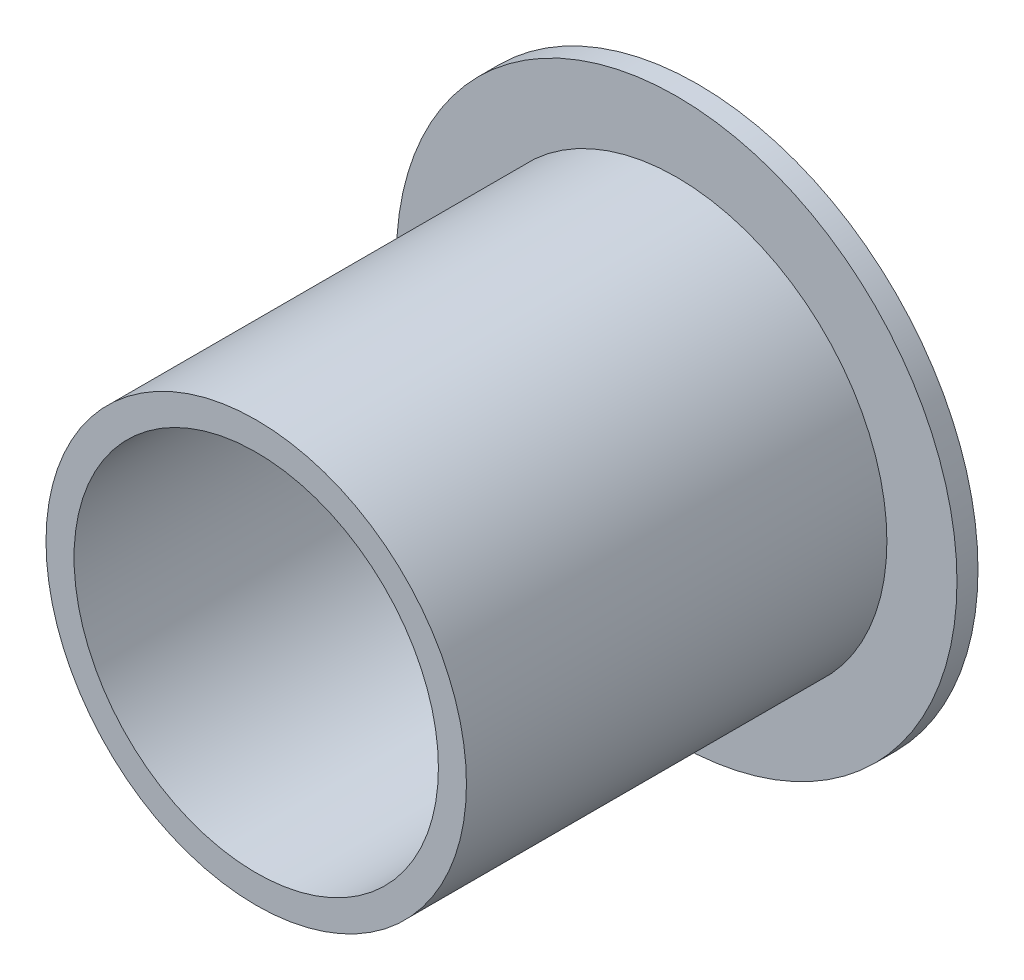
from build123d import *

# Parameters (mm, degrees)
SKETCH1_R           = 20
BOSS_EXTRUDE1_DEPTH = 1.5
SKETCH2_R           = 15
SKETCH2_R_2         = 13
BOSS_EXTRUDE2_DEPTH = 30
SKETCH3_R           = 10
CUT_EXTRUDE1_DEPTH  = 30


with BuildPart() as part:
    # Sketch1 → Boss-Extrude1 (new body)
    with BuildSketch(Plane.XY):
        Circle(SKETCH1_R)
    extrude(amount=BOSS_EXTRUDE1_DEPTH)

    # Sketch2 → Boss-Extrude2 (add)
    with BuildSketch(Plane.XY.offset(1.5)):
        Circle(SKETCH2_R)
        Circle(SKETCH2_R_2, mode=Mode.SUBTRACT)
    extrude(amount=BOSS_EXTRUDE2_DEPTH)

    # Sketch3 → Cut-Extrude1 (cut)
    with BuildSketch(Plane(origin=(0, 0, 0), x_dir=(-1, 0, 0), z_dir=(0, 0, -1))):
        Circle(SKETCH3_R)
    extrude(amount=-CUT_EXTRUDE1_DEPTH, mode=Mode.SUBTRACT)


solid = part.part
